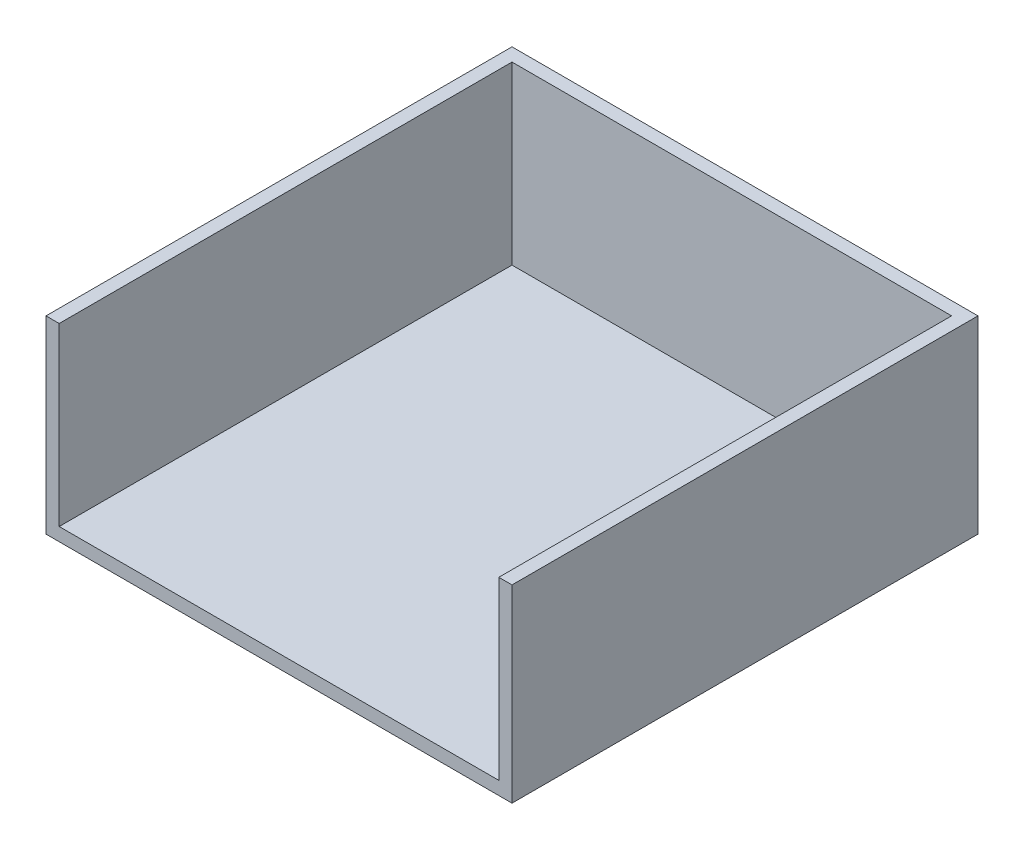
from build123d import *

# Parameters (mm, degrees)
SKETCH1_W           = 53
SKETCH1_H           = 53
BOSS_EXTRUDE1_DEPTH = 1.5
BOSS_EXTRUDE2_DEPTH = 20


with BuildPart() as part:
    # Sketch1 → Boss-Extrude1 (new body)
    with BuildSketch(Plane(origin=(0, 0, 0), x_dir=(1, 0, 0), z_dir=(0, 1, 0))):
        with Locations((26.5, 26.5)):
            Rectangle(SKETCH1_W, SKETCH1_H)
    extrude(amount=BOSS_EXTRUDE1_DEPTH)

    # Sketch3 → Boss-Extrude2 (add)
    with BuildSketch(Plane(origin=(0, 1.5, 0), x_dir=(1, 0, 0), z_dir=(0, 1, 0))):
        Polygon((0, 0), (0, 53), (53, 53), (53, 0), (51.5, 0), (51.5, 51.5), (1.5, 51.5), (1.5, 0), align=None)
    extrude(amount=BOSS_EXTRUDE2_DEPTH)


solid = part.part
